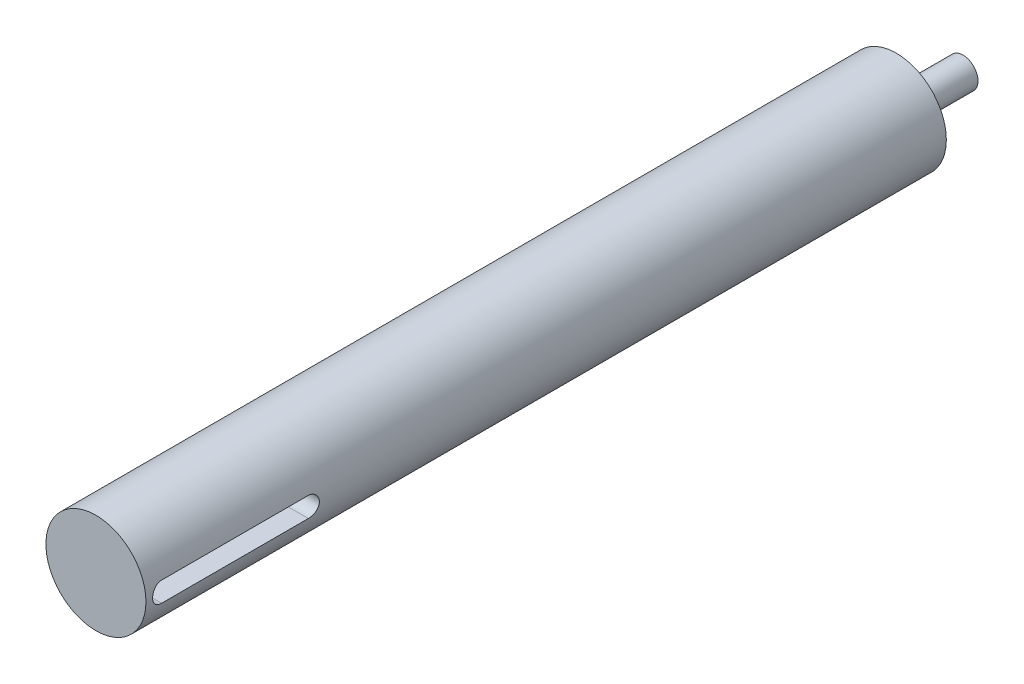
from build123d import *

# Parameters (mm, degrees)
SKETCH_1_R          = 15
EXTRUDE_1_DEPTH     = 240
SKETCH_4_R          = 4.5
EXTRUDE_2_DEPTH     = 20
CUT_EXTRUDE_3_DEPTH = 8


with BuildPart() as part:
    # 草图1 → 凸台-拉伸1 (new body)
    with BuildSketch(Plane.XY):
        Circle(SKETCH_1_R)
    extrude(amount=EXTRUDE_1_DEPTH)

    # 草图4 → 凸台-拉伸2 (add)
    with BuildSketch(Plane(origin=(0, 0, 0), x_dir=(-1, 0, 0), z_dir=(0, 0, -1))):
        Circle(SKETCH_4_R)
    extrude(amount=EXTRUDE_2_DEPTH)

    # 草图5 → 切除-拉伸3 (cut)
    with BuildSketch(Plane(origin=(15, 0, 0), x_dir=(0, 0, -1), z_dir=(1, 0, 0))):
        with BuildLine():
            Line((-235, 3), (-191, 3))
            ThreePointArc((-191, 3), (-188, 0), (-191, -3))
            Line((-191, -3), (-235, -3))
            ThreePointArc((-235, -3), (-238, 0), (-235, 3))
        make_face()
    extrude(amount=-CUT_EXTRUDE_3_DEPTH, mode=Mode.SUBTRACT)


solid = part.part
